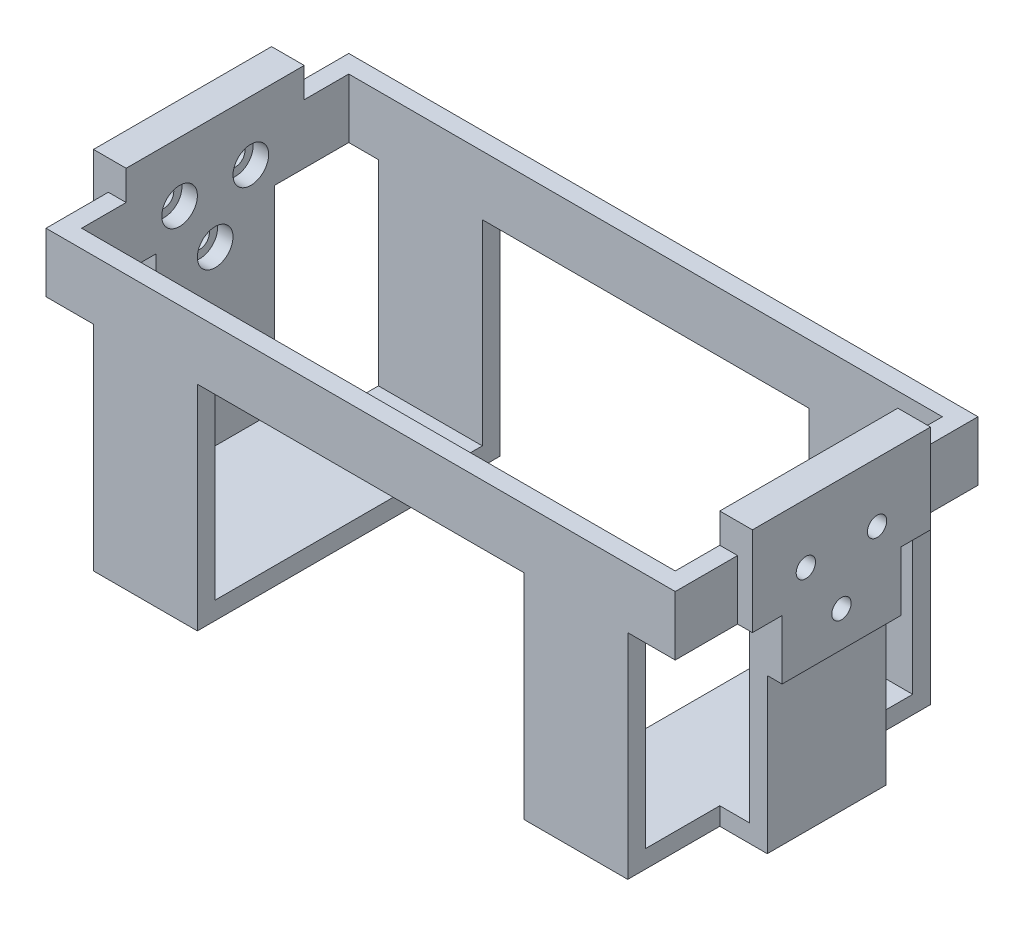
from build123d import *

# Parameters (mm, degrees)
EXTRUDE_1_DEPTH     = 3
EXTRUDE_1_2_DEPTH   = 3
SKETCH_2_W          = 17.5
SKETCH_2_H          = 3
SKETCH_2_W_2        = 3
SKETCH_2_H_2        = 20
EXTRUDE_2_DEPTH     = 43
SKETCH_3_W          = 55
SKETCH_3_H          = 3
EXTRUDE_3_DEPTH     = 10
EXTRUDE_4_DEPTH     = 2.5
SKETCH_5_R          = 3
CUT_EXTRUDE_1_DEPTH = 2.6
SKETCH_7_R          = 1.625
CUT_EXTRUDE_2_DEPTH = 118.972920622
SKETCH_8_W          = 5.5
SKETCH_8_H          = 30
EXTRUDE_5_DEPTH     = 5


with BuildPart() as part:
    # Эскиз1 → Бобышка-Вытянуть1 (new body)
    with BuildSketch(Plane(origin=(0, 0, 0), x_dir=(1, 0, 0), z_dir=(0, 1, 0))):
        Polygon((27.5, 25.5), (45, 25.5), (45, 10), (53, 10), (53, -10), (45, -10), (45, -25.5), (27.5, -25.5), align=None)
    extrude(amount=EXTRUDE_1_DEPTH)



with BuildPart() as body_2:
    # Эскиз1 → Extrude 1 2 (new body)
    with BuildSketch(Plane(origin=(0, 0, 0), x_dir=(1, 0, 0), z_dir=(0, 1, 0))):
        Polygon((-27.5, -25.5), (-27.5, 25.5), (-45, 25.5), (-45, 10), (-53, 10), (-53, -10), (-45, -10), (-45, -25.5), align=None)
    extrude(amount=EXTRUDE_1_2_DEPTH)


with BuildPart() as part_1:
    add(part.part)

    add(body_2.part)  # Бобышка-Вытянуть2 merges body 2
    # Эскиз2 → Бобышка-Вытянуть2 (add)
    with BuildSketch(Plane(origin=(0, 3, 0), x_dir=(1, 0, 0), z_dir=(0, 1, 0))):
        with Locations((36.25, 24)):
            Rectangle(SKETCH_2_W, SKETCH_2_H)
        with Locations((51.5, 0)):
            Rectangle(SKETCH_2_W_2, SKETCH_2_H_2)
        with Locations((36.25, -24)):
            Rectangle(SKETCH_2_W, SKETCH_2_H)
        with Locations((-36.25, -24)):
            Rectangle(SKETCH_2_W, SKETCH_2_H)
        with Locations((-51.5, 0)):
            Rectangle(SKETCH_2_W_2, SKETCH_2_H_2)
        with Locations((-36.25, 24)):
            Rectangle(SKETCH_2_W, SKETCH_2_H)
    extrude(amount=EXTRUDE_2_DEPTH)

    # Эскиз3 → Бобышка-Вытянуть3 (add)
    with BuildSketch(Plane(origin=(0, 46, 0), x_dir=(1, 0, 0), z_dir=(0, 1, 0))):
        Polygon((45, 25.5), (53, 25.5), (53, 10), (50, 10), (50, 22.5), (45, 22.5), align=None)
        with Locations((0, 24)):
            Rectangle(SKETCH_3_W, SKETCH_3_H)
        Polygon((-45, 22.5), (-45, 25.5), (-53, 25.5), (-53, 10), (-50, 10), (-50, 22.5), align=None)
        Polygon((-45, -25.5), (-53, -25.5), (-53, -10), (-50, -10), (-50, -22.5), (-45, -22.5), align=None)
        Polygon((45, -22.5), (45, -25.5), (53, -25.5), (53, -10), (50, -10), (50, -22.5), align=None)
        with Locations((0, -24)):
            Rectangle(SKETCH_3_W, SKETCH_3_H)
    extrude(amount=-EXTRUDE_3_DEPTH)

    # Эскиз4 → Бобышка-Вытянуть4 (add)
    with BuildSketch(Plane.ZY.offset(53)):
        Polygon((-10, 26), (10, 26), (10, 36), (15, 36), (15, 46), (-15, 46), (-15, 36), (-10, 36), align=None)
    extrude_4 = extrude(amount=EXTRUDE_4_DEPTH)

    # Эскиз5 → Вырез-Вытянуть1 (cut)
    with BuildSketch(Plane(origin=(-50, 0, 0), x_dir=(0, 0, -1), z_dir=(1, 0, 0))):
        with Locations((-6, 41)):
            Circle(SKETCH_5_R)
        with Locations((0, 32)):
            Circle(SKETCH_5_R)
        with Locations(Location((6, 41, 0), (0, 0, 180))):
            Circle(SKETCH_5_R)
    cut_extrude_1 = extrude(amount=-CUT_EXTRUDE_1_DEPTH, mode=Mode.SUBTRACT)

    # Эскиз7 → Вырез-Вытянуть2 (cut, through all)
    with BuildSketch(Plane(origin=(-52.6, 0, 0), x_dir=(0, 0, -1), z_dir=(1, 0, 0))):
        with Locations((-6, 41)):
            Circle(SKETCH_7_R)
        with Locations((6, 41)):
            Circle(SKETCH_7_R)
        with Locations((0, 32)):
            Circle(SKETCH_7_R)
    cut_extrude_2 = extrude(amount=-CUT_EXTRUDE_2_DEPTH, mode=Mode.SUBTRACT)

    # Зеркальное отражение2: Бобышка-Вытянуть4, Вырез-Вытянуть1, Вырез-Вытянуть2 across plane
    add(extrude_4.mirror(Plane(origin=(0, 0, 0), x_dir=(0, 0, 1), z_dir=(1, 0, 0))))
    add(cut_extrude_1.mirror(Plane(origin=(0, 0, 0), x_dir=(0, 0, 1), z_dir=(1, 0, 0))), mode=Mode.SUBTRACT)
    add(cut_extrude_2.mirror(Plane(origin=(0, 0, 0), x_dir=(0, 0, 1), z_dir=(1, 0, 0))), mode=Mode.SUBTRACT)

    # Эскиз8 → Бобышка-Вытянуть5 (add)
    with BuildSketch(Plane(origin=(0, 46, 0), x_dir=(1, 0, 0), z_dir=(0, 1, 0))):
        with Locations((-52.75, 0)):
            Rectangle(SKETCH_8_W, SKETCH_8_H)
        with Locations((52.75, 0)):
            Rectangle(SKETCH_8_W, SKETCH_8_H)
    extrude(amount=EXTRUDE_5_DEPTH)


solid = part_1.part
